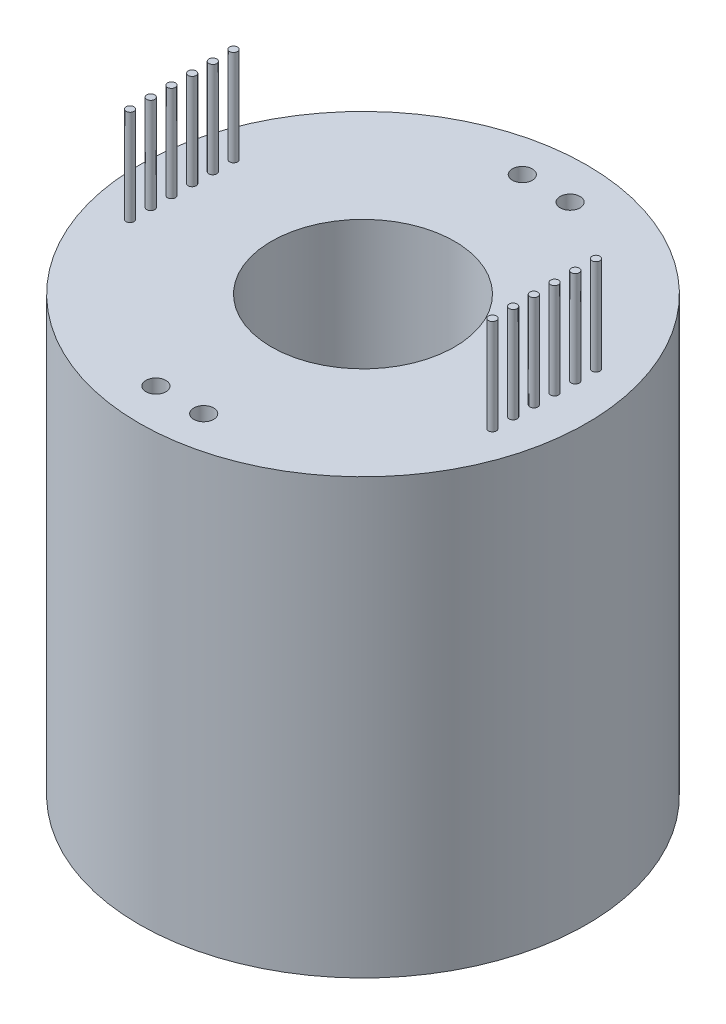
from build123d import *

# Parameters (mm, degrees)
SKETCH1_W                 = 28.09
SKETCH1_H                 = 54.5
M3X0_5_TAPPED_HOLE1_D     = 2.5
M3X0_5_TAPPED_HOLE1_DEPTH = 4.99999
M3X0_5_TAPPED_HOLE1_TIP   = 0.751075774
SKETCH6_R                 = 0.5
BOSS_EXTRUDE1_DEPTH       = 12
BOSS_EXTRUDE1_2_DEPTH     = 12
BOSS_EXTRUDE1_3_DEPTH     = 12
BOSS_EXTRUDE1_4_DEPTH     = 12
BOSS_EXTRUDE1_5_DEPTH     = 12
BOSS_EXTRUDE1_6_DEPTH     = 12
BOSS_EXTRUDE1_7_DEPTH     = 12
BOSS_EXTRUDE1_8_DEPTH     = 12
BOSS_EXTRUDE1_9_DEPTH     = 12
BOSS_EXTRUDE1_10_DEPTH    = 12
BOSS_EXTRUDE1_11_DEPTH    = 12
BOSS_EXTRUDE1_12_DEPTH    = 12
SKETCH8_R                 = 11.5
CUT_EXTRUDE1_DEPTH        = 68.441427921


with BuildPart() as part:
    # Sketch1 → Revolve1 (revolve)
    with BuildSketch(Plane.XY, mode=Mode.PRIVATE) as revolve1_sk:
        with Locations((14.045, 27.25)):
            Rectangle(SKETCH1_W, SKETCH1_H)
    revolve(revolve1_sk.sketch.rotate(Axis((0, 0, 0), (0, 1, 0)), 90), axis=Axis((0, 0, 0), (0, 1, 0)))

    # Sketch3 → 1/4 NPT Tapped Hole1 (revolve, cut)
    with BuildSketch(Plane(origin=(0, 54.5, 0), x_dir=(0, 0, 1), z_dir=(1, 0, 0))):
        Polygon((0, 0), (0, 54.5), (5.5626, 54.5), (5.5626, 10.0203), (6.557978799, 10.0203), (6.858, 0), align=None)
    revolve(axis=Axis((0, 60.85, 0), (0, -1, 0)), mode=Mode.SUBTRACT)

    # M3x0.5 Tapped Hole1
    with Locations(Plane(origin=(0, 54.5, 0), x_dir=(1, 0, 0), z_dir=(0, 1, 0))):
        with Locations((-3, 23), (3, -23), (-3, -23), (3, 23)):
            Hole(M3X0_5_TAPPED_HOLE1_D / 2, depth=M3X0_5_TAPPED_HOLE1_DEPTH)
            with Locations((0, 0, -(M3X0_5_TAPPED_HOLE1_DEPTH + M3X0_5_TAPPED_HOLE1_TIP / 2))):  # 118° drill point
                Cone(0, M3X0_5_TAPPED_HOLE1_D / 2, M3X0_5_TAPPED_HOLE1_TIP, mode=Mode.SUBTRACT)

    # Sketch8 → Cut-Extrude1 (cut, through all)
    with BuildSketch(Plane(origin=(0, 54.5, 0), x_dir=(1, 0, 0), z_dir=(0, 1, 0))):
        with Locations(Location((0, 0, 0), (0, 0, 270))):
            Circle(SKETCH8_R)
    extrude(amount=-CUT_EXTRUDE1_DEPTH, mode=Mode.SUBTRACT)


with BuildPart() as body_2:
    # Sketch6 → Boss-Extrude1 (new body)
    with BuildSketch(Plane(origin=(0, 54.5, 0), x_dir=(1, 0, 0), z_dir=(0, 1, 0))):
        with Locations(Location((-22.75, 6.5, 0), (0, 0, 270))):
            Circle(SKETCH6_R)
    extrude(amount=BOSS_EXTRUDE1_DEPTH)


with BuildPart() as body_3:
    # Sketch6 → Boss-Extrude1 2 (new body)
    with BuildSketch(Plane(origin=(0, 54.5, 0), x_dir=(1, 0, 0), z_dir=(0, 1, 0))):
        with Locations(Location((-22.75, 3.9, 0), (0, 0, 270))):
            Circle(SKETCH6_R)
    extrude(amount=BOSS_EXTRUDE1_2_DEPTH)


with BuildPart() as body_4:
    # Sketch6 → Boss-Extrude1 3 (new body)
    with BuildSketch(Plane(origin=(0, 54.5, 0), x_dir=(1, 0, 0), z_dir=(0, 1, 0))):
        with Locations(Location((-22.75, 1.3, 0), (0, 0, 270))):
            Circle(SKETCH6_R)
    extrude(amount=BOSS_EXTRUDE1_3_DEPTH)


with BuildPart() as body_5:
    # Sketch6 → Boss-Extrude1 4 (new body)
    with BuildSketch(Plane(origin=(0, 54.5, 0), x_dir=(1, 0, 0), z_dir=(0, 1, 0))):
        with Locations(Location((-22.75, -1.3, 0), (0, 0, 270))):
            Circle(SKETCH6_R)
    extrude(amount=BOSS_EXTRUDE1_4_DEPTH)


with BuildPart() as body_6:
    # Sketch6 → Boss-Extrude1 5 (new body)
    with BuildSketch(Plane(origin=(0, 54.5, 0), x_dir=(1, 0, 0), z_dir=(0, 1, 0))):
        with Locations(Location((-22.75, -3.9, 0), (0, 0, 270))):
            Circle(SKETCH6_R)
    extrude(amount=BOSS_EXTRUDE1_5_DEPTH)


with BuildPart() as body_7:
    # Sketch6 → Boss-Extrude1 6 (new body)
    with BuildSketch(Plane(origin=(0, 54.5, 0), x_dir=(1, 0, 0), z_dir=(0, 1, 0))):
        with Locations(Location((-22.75, -6.5, 0), (0, 0, 270))):
            Circle(SKETCH6_R)
    extrude(amount=BOSS_EXTRUDE1_6_DEPTH)


with BuildPart() as body_8:
    # Sketch6 → Boss-Extrude1 7 (new body)
    with BuildSketch(Plane(origin=(0, 54.5, 0), x_dir=(1, 0, 0), z_dir=(0, 1, 0))):
        with Locations(Location((22.75, -6.5, 0), (0, 0, 90))):
            Circle(SKETCH6_R)
    extrude(amount=BOSS_EXTRUDE1_7_DEPTH)


with BuildPart() as body_9:
    # Sketch6 → Boss-Extrude1 8 (new body)
    with BuildSketch(Plane(origin=(0, 54.5, 0), x_dir=(1, 0, 0), z_dir=(0, 1, 0))):
        with Locations(Location((22.75, -3.9, 0), (0, 0, 90))):
            Circle(SKETCH6_R)
    extrude(amount=BOSS_EXTRUDE1_8_DEPTH)


with BuildPart() as body_10:
    # Sketch6 → Boss-Extrude1 9 (new body)
    with BuildSketch(Plane(origin=(0, 54.5, 0), x_dir=(1, 0, 0), z_dir=(0, 1, 0))):
        with Locations(Location((22.75, -1.3, 0), (0, 0, 90))):
            Circle(SKETCH6_R)
    extrude(amount=BOSS_EXTRUDE1_9_DEPTH)


with BuildPart() as body_11:
    # Sketch6 → Boss-Extrude1 10 (new body)
    with BuildSketch(Plane(origin=(0, 54.5, 0), x_dir=(1, 0, 0), z_dir=(0, 1, 0))):
        with Locations(Location((22.75, 1.3, 0), (0, 0, 90))):
            Circle(SKETCH6_R)
    extrude(amount=BOSS_EXTRUDE1_10_DEPTH)


with BuildPart() as body_12:
    # Sketch6 → Boss-Extrude1 11 (new body)
    with BuildSketch(Plane(origin=(0, 54.5, 0), x_dir=(1, 0, 0), z_dir=(0, 1, 0))):
        with Locations(Location((22.75, 3.9, 0), (0, 0, 90))):
            Circle(SKETCH6_R)
    extrude(amount=BOSS_EXTRUDE1_11_DEPTH)


with BuildPart() as body_13:
    # Sketch6 → Boss-Extrude1 12 (new body)
    with BuildSketch(Plane(origin=(0, 54.5, 0), x_dir=(1, 0, 0), z_dir=(0, 1, 0))):
        with Locations(Location((22.75, 6.5, 0), (0, 0, 90))):
            Circle(SKETCH6_R)
    extrude(amount=BOSS_EXTRUDE1_12_DEPTH)


solid = Compound([part.part, body_2.part, body_3.part, body_4.part, body_5.part, body_6.part, body_7.part, body_8.part, body_9.part, body_10.part, body_11.part, body_12.part, body_13.part])
